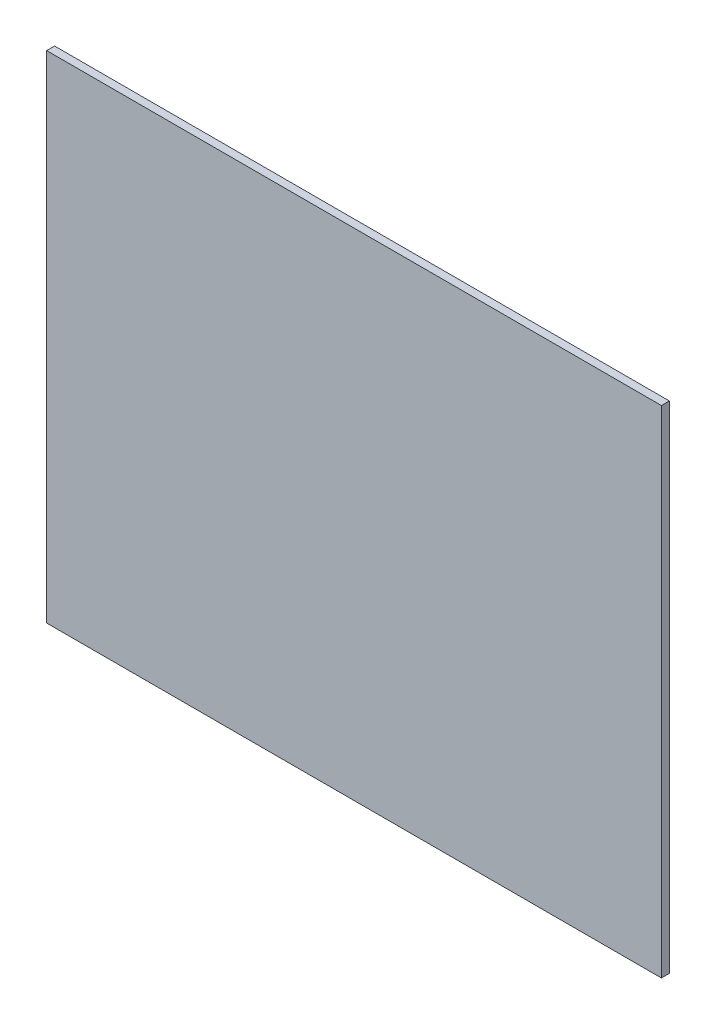
from build123d import *

# Parameters (mm, degrees)
SKETCH1_W           = 155
SKETCH1_H           = 125
BOSS_EXTRUDE1_DEPTH = 2


with BuildPart() as part:
    # Sketch1 → Boss-Extrude1 (new body)
    with BuildSketch(Plane.XY):
        Rectangle(SKETCH1_W, SKETCH1_H)
    extrude(amount=BOSS_EXTRUDE1_DEPTH)


solid = part.part
